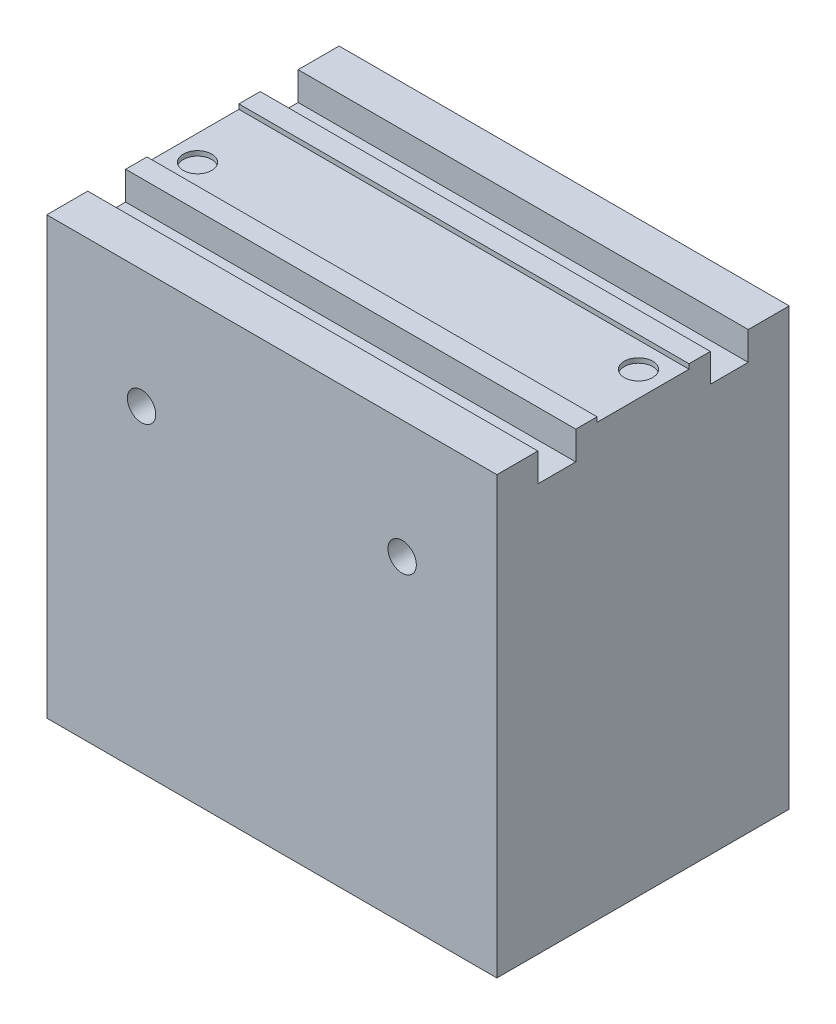
from build123d import *

# Parameters (mm, degrees)
SKETCH_1_W           = 95
SKETCH_1_H           = 61.7
EXTRUDE_1_DEPTH      = 93
SKETCH_3_OUTSIDE_W   = 126.312
SKETCH_3_OUTSIDE_H   = 93.012
SKETCH_3_OUTSIDE_W_2 = 95
SKETCH_3_OUTSIDE_H_2 = 19.4
CUT_EXTRUDE_1_DEPTH  = 1
SKETCH_4_R           = 3
CUT_EXTRUDE_2_DEPTH  = 3
SKETCH_5_W           = 95
SKETCH_5_H           = 8
CUT_EXTRUDE_3_DEPTH  = 6
SKETCH_6_W           = 95
SKETCH_6_H           = 19.4
CUT_EXTRUDE_4_DEPTH  = 2
SKETCH_7_R           = 3
CUT_EXTRUDE_5_DEPTH  = 121.528585821


with BuildPart() as part:
    # 草图1 → 凸台-拉伸1 (new body)
    with BuildSketch(Plane(origin=(0, 0, 0), x_dir=(1, 0, 0), z_dir=(0, 1, 0))):
        Rectangle(SKETCH_1_W, SKETCH_1_H)
    extrude(amount=EXTRUDE_1_DEPTH)

    # 草图3 outside → 切除-拉伸1 (cut)
    with BuildSketch(Plane(origin=(0, 93, 0), x_dir=(1, 0, 0), z_dir=(0, 1, 0))):
        Rectangle(SKETCH_3_OUTSIDE_W, SKETCH_3_OUTSIDE_H)
        Rectangle(SKETCH_3_OUTSIDE_W_2, SKETCH_3_OUTSIDE_H_2, mode=Mode.SUBTRACT)
    extrude(amount=-CUT_EXTRUDE_1_DEPTH, mode=Mode.SUBTRACT)

    # 草图4 → 切除-拉伸2 (cut)
    with BuildSketch(Plane(origin=(0, 93, 0), x_dir=(1, 0, 0), z_dir=(0, 1, 0))):
        with Locations(Location((-42.196054271, -4.338164654, 0), (0, 0, 270))):
            Circle(SKETCH_4_R)
        with Locations(Location((42.196054271, 4.338164654, 0), (0, 0, 270))):
            Circle(SKETCH_4_R)
    extrude(amount=-CUT_EXTRUDE_2_DEPTH, mode=Mode.SUBTRACT)

    # 草图5 → 切除-拉伸3 (cut)
    with BuildSketch(Plane(origin=(0, 92, 0), x_dir=(1, 0, 0), z_dir=(0, 1, 0))):
        with Locations((0, -18.2)):
            Rectangle(SKETCH_5_W, SKETCH_5_H)
        with Locations((0, 18.2)):
            Rectangle(SKETCH_5_W, SKETCH_5_H)
    extrude(amount=-CUT_EXTRUDE_3_DEPTH, mode=Mode.SUBTRACT)

    # 草图6 → 切除-拉伸4 (cut)
    with BuildSketch(Plane(origin=(0, 93, 0), x_dir=(1, 0, 0), z_dir=(0, 1, 0))):
        Rectangle(SKETCH_6_W, SKETCH_6_H)
    extrude(amount=-CUT_EXTRUDE_4_DEPTH, mode=Mode.SUBTRACT)

    # 草图7 → 切除-拉伸5 (cut, through all)
    with BuildSketch(Plane.XY.offset(30.85)):
        with Locations((-27.5, 67)):
            Circle(SKETCH_7_R)
        with Locations(Location((27.5, 67, 0), (0, 0, 180))):
            Circle(SKETCH_7_R)
    extrude(amount=-CUT_EXTRUDE_5_DEPTH, mode=Mode.SUBTRACT)


solid = part.part
